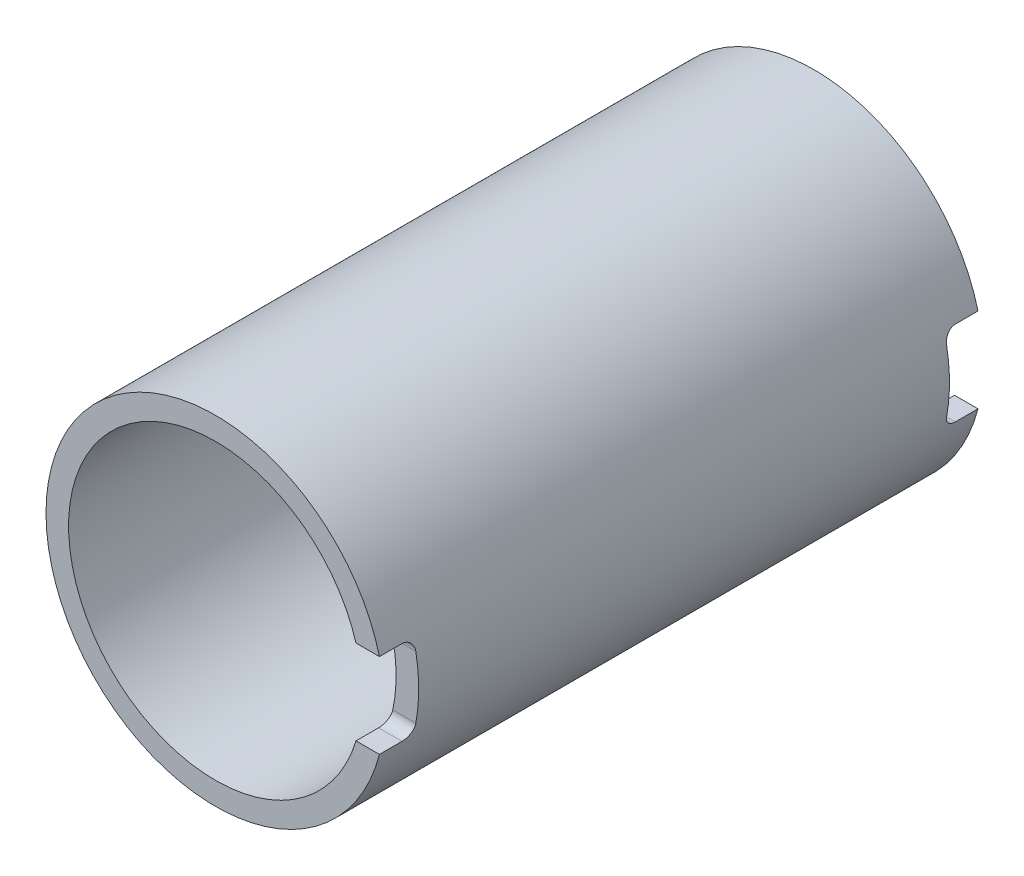
from build123d import *

# Parameters (mm, degrees)
SKETCH2_R               = 15
SKETCH2_R_2             = 13
BOSS_EXTRUDE1_DEPTH     = 26.5
CUT_EXTRUDE1_REACH      = 35.945
CUT_EXTRUDE1_END_RADIUS = 15


with BuildPart() as part:
    # Sketch2 → Boss-Extrude1 (new, symmetric)
    with BuildSketch(Plane.XY):
        Circle(SKETCH2_R)
        Circle(SKETCH2_R_2, mode=Mode.SUBTRACT)
    extrude(amount=BOSS_EXTRUDE1_DEPTH, both=True)

    # Cut-Extrude1: up to this cylinder (the profile starts inside it)
    cut_extrude1_end = Plane(origin=(0, 0, 0), z_dir=(0, 0, -1)) * Cylinder(CUT_EXTRUDE1_END_RADIUS, 152.939652, mode=Mode.PRIVATE)
    # Sketch3 → Cut-Extrude1 (cut, up to the surface)
    with BuildSketch(Plane(origin=(0, 0, 0), x_dir=(0, 0, -1), z_dir=(1, 0, 0)), mode=Mode.PRIVATE) as cut_extrude1_sk1:
        with BuildLine():
            Line((-26.5, -3.75), (-24.5, -3.75))
            ThreePointArc((-24.5, -3.75), (-23.792893219, -3.457106781), (-23.5, -2.75))
            Line((-23.5, -2.75), (-23.5, 2.75))
            ThreePointArc((-23.5, 2.75), (-23.792893219, 3.457106781), (-24.5, 3.75))
            Line((-24.5, 3.75), (-26.5, 3.75))
            Line((-26.5, 3.75), (-26.5, -3.75))
        make_face()
    cut_extrude1_tool1 = extrude(cut_extrude1_sk1.sketch, amount=CUT_EXTRUDE1_REACH, mode=Mode.PRIVATE) & cut_extrude1_end
    add(cut_extrude1_tool1.solids().sort_by_distance((0, 0, 25.024826))[0], mode=Mode.SUBTRACT)
    # Sketch3 → Cut-Extrude1 (cut, up to the surface)
    with BuildSketch(Plane(origin=(0, 0, 0), x_dir=(0, 0, -1), z_dir=(1, 0, 0)), mode=Mode.PRIVATE) as cut_extrude1_sk2:
        with BuildLine():
            Line((26.5, -3.75), (24.5, -3.75))
            ThreePointArc((24.5, -3.75), (23.792893219, -3.457106781), (23.5, -2.75))
            Line((23.5, -2.75), (23.5, 2.75))
            ThreePointArc((23.5, 2.75), (23.792893219, 3.457106781), (24.5, 3.75))
            Line((24.5, 3.75), (26.5, 3.75))
            Line((26.5, 3.75), (26.5, -3.75))
        make_face()
    cut_extrude1_tool2 = extrude(cut_extrude1_sk2.sketch, amount=CUT_EXTRUDE1_REACH, mode=Mode.PRIVATE) & cut_extrude1_end
    add(cut_extrude1_tool2.solids().sort_by_distance((0, 0, -25.024826))[0], mode=Mode.SUBTRACT)


solid = part.part
